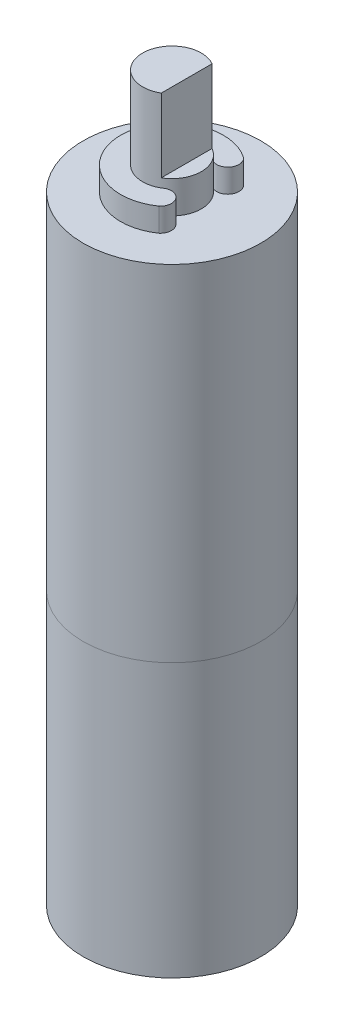
from build123d import *

# Parameters (mm, degrees)
SKETCH3_R           = 3.025
BOSS_EXTRUDE1_DEPTH = 9.3
SKETCH4_R           = 3.025
BOSS_EXTRUDE4_DEPTH = 11.75
BOSS_EXTRUDE5_DEPTH = 0.8
BOSS_EXTRUDE6_DEPTH = 3.6
BOSS_EXTRUDE7_DEPTH = 1.1


with BuildPart() as part:
    # Sketch3 → Boss-Extrude1 (new body)
    with BuildSketch(Plane(origin=(0, 0, 0), x_dir=(1, 0, 0), z_dir=(0, 1, 0))):
        Circle(SKETCH3_R)
    extrude(amount=BOSS_EXTRUDE1_DEPTH)


with BuildPart() as body_2:
    # Sketch4 → Boss-Extrude4 (new body)
    with BuildSketch(Plane(origin=(0, 9.3, 0), x_dir=(1, 0, 0), z_dir=(0, 1, 0))):
        Circle(SKETCH4_R)
    extrude(amount=BOSS_EXTRUDE4_DEPTH)

    # Sketch5 → Boss-Extrude5 (add)
    with BuildSketch(Plane(origin=(0, 21.05, 0), x_dir=(1, 0, 0), z_dir=(0, 1, 0))):
        with BuildLine():
            ThreePointArc((0.5, -0.866025404), (-1, 0), (0.5, 0.866025404))
            ThreePointArc((0.5, 0.866025404), (0.5459595, 0.837811569), (0.590331188, 0.807161129))
            ThreePointArc((0.590331188, 0.807161129), (1.067738399, 0.9440258), (1.00014128, 1.436042276))
            ThreePointArc((1.00014128, 1.436042276), (-1.75, 0), (1.00014128, -1.436042276))
            ThreePointArc((1.00014128, -1.436042276), (1.067738399, -0.9440258), (0.590331188, -0.807161129))
            ThreePointArc((0.590331188, -0.807161129), (0.5459595, -0.837811569), (0.5, -0.866025404))
        make_face()
    extrude(amount=BOSS_EXTRUDE5_DEPTH)

    # Sketch5<4> → Boss-Extrude6 (add)
    with BuildSketch(Plane(origin=(0, 21.05, 0), x_dir=(1, 0, 0), z_dir=(0, 1, 0))):
        with BuildLine():
            Line((0.5, -0.866025404), (0.5, 0.866025404))
            ThreePointArc((0.5, 0.866025404), (-1, 0), (0.5, -0.866025404))
        make_face()
    extrude(amount=BOSS_EXTRUDE6_DEPTH)

    # Sketch5<5> → Boss-Extrude7 (add)
    with BuildSketch(Plane(origin=(0, 21.05, 0), x_dir=(1, 0, 0), z_dir=(0, 1, 0))):
        with BuildLine():
            ThreePointArc((0.590331188, 0.807161129), (0.5459595, 0.837811569), (0.5, 0.866025404))
            Line((0.5, 0.866025404), (0.5, -0.866025404))
            ThreePointArc((0.5, -0.866025404), (0.5459595, -0.837811569), (0.590331188, -0.807161129))
            ThreePointArc((0.590331188, -0.807161129), (1, 0), (0.590331188, 0.807161129))
        make_face()
    extrude(amount=BOSS_EXTRUDE7_DEPTH)


solid = Compound([part.part, body_2.part])
